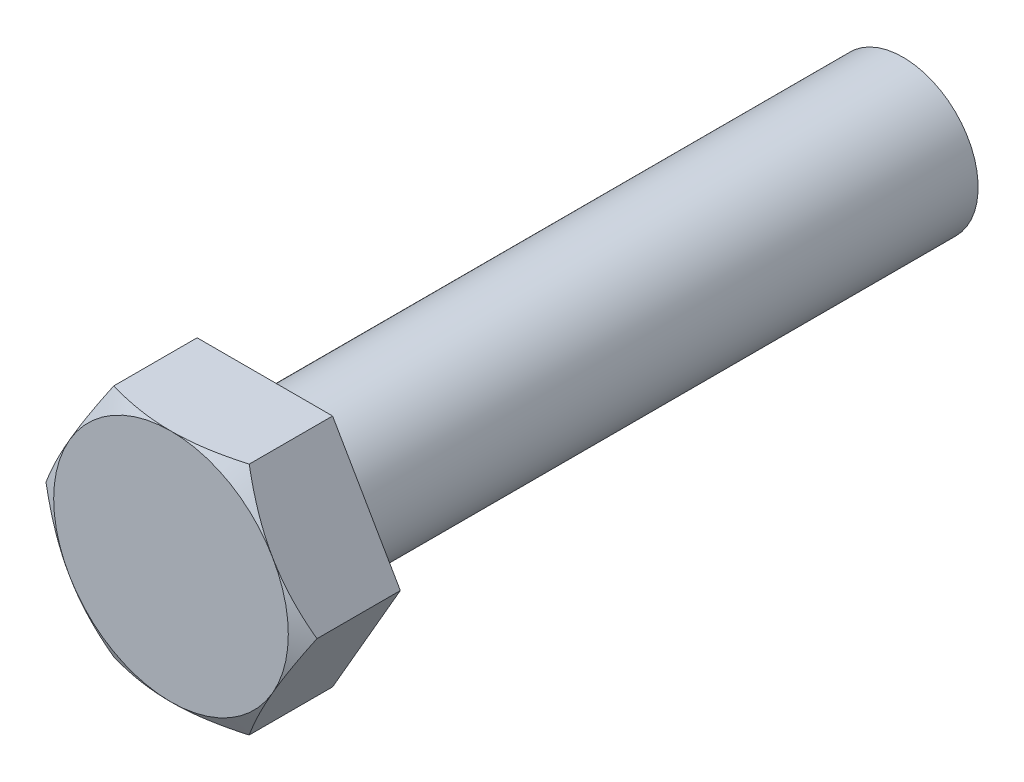
from build123d import *

# Parameters (mm, degrees)
Y_KSEKLIK_EKSTR_ZYON1_DEPTH = 10
IZIM2_R                     = 8
Y_KSEKLIK_EKSTR_ZYON2_DEPTH = 68
IZIM3_OUTSIDE_W             = 82.878
IZIM3_OUTSIDE_H             = 79.01
IZIM3_OUTSIDE_R             = 12.5
KES_EKSTR_ZYON2_DEPTH       = 10
KES_EKSTR_ZYON2_DRAFT       = -60


with BuildPart() as part:
    # Çizim1 → Yükseklik-Ekstrüzyon1 (new body)
    with BuildSketch(Plane.XY):
        Polygon((14.43375673, 0), (7.216878365, 12.5), (-7.216878365, 12.5), (-14.43375673, 0), (-7.216878365, -12.5), (7.216878365, -12.5), align=None)
    extrude(amount=Y_KSEKLIK_EKSTR_ZYON1_DEPTH)

    # Çizim2 → Yükseklik-Ekstrüzyon2 (add)
    with BuildSketch(Plane(origin=(0, 0, 0), x_dir=(-1, 0, 0), z_dir=(0, 0, -1))):
        Circle(IZIM2_R)
    extrude(amount=Y_KSEKLIK_EKSTR_ZYON2_DEPTH)


with BuildPart() as kes_ekstr_zyon2_tool:
    # Çizim3 outside → Kes-Ekstrüzyon2 (with draft: the straight prism first)
    with BuildSketch(Plane.XY.offset(10)):
        Rectangle(IZIM3_OUTSIDE_W, IZIM3_OUTSIDE_H)
        Circle(IZIM3_OUTSIDE_R, mode=Mode.SUBTRACT)
    extrude(amount=-KES_EKSTR_ZYON2_DEPTH)
    # Kes-Ekstrüzyon2: the draft: its side faces are tilted about the plane it starts from
    kes_ekstr_zyon2_sides = [kes_ekstr_zyon2_tool.faces().sort_by_distance(p)[0] for p in [
        (0, -39.505, 5),
        (41.439, 0, 5),
        (0, 39.505, 5),
        (-41.439, 0, 5),
        (-12.5, 0, 5),
    ]]
    draft(kes_ekstr_zyon2_sides, Plane.XY.offset(10), KES_EKSTR_ZYON2_DRAFT)


with BuildPart() as part_1:
    add(part.part)

    # Kes-Ekstrüzyon2: cut by kes_ekstr_zyon2_tool
    add(kes_ekstr_zyon2_tool.part, mode=Mode.SUBTRACT)


solid = part_1.part
